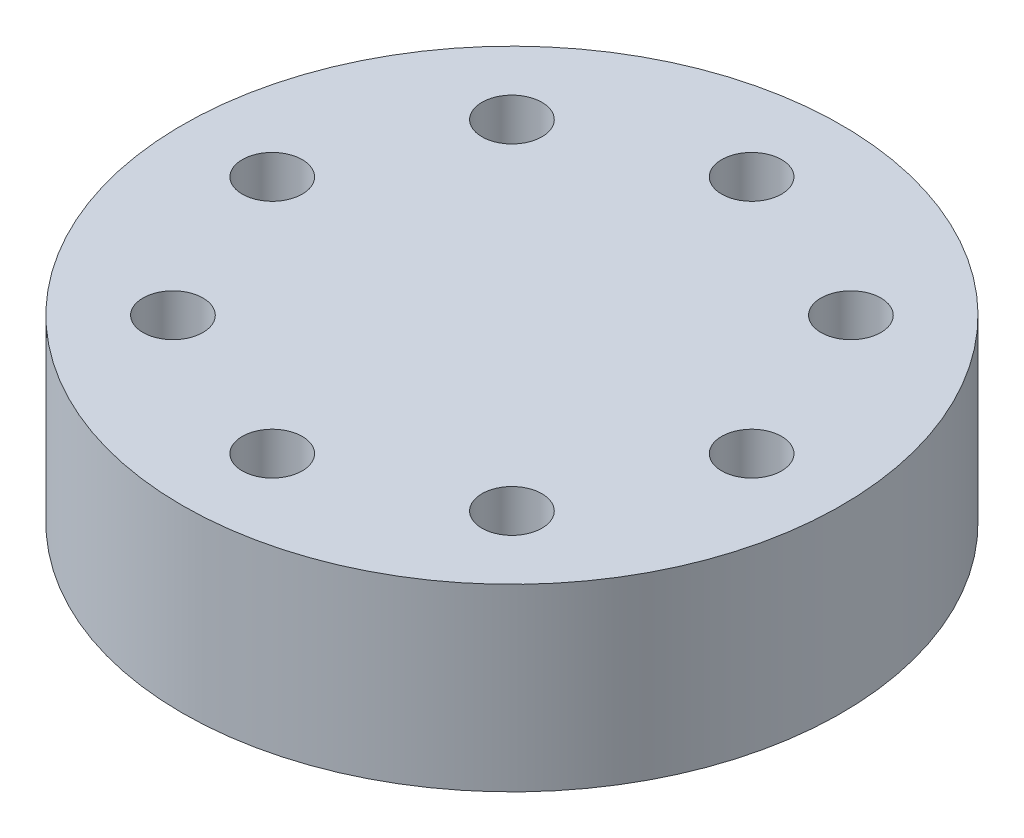
from build123d import *

# Parameters (mm, degrees)
SKETCH1_R           = 11
SKETCH1_R_2         = 1
BOSS_EXTRUDE1_DEPTH = 6
SKETCH2_R           = 4
CUT_EXTRUDE1_DEPTH  = 5.5


with BuildPart() as part:
    # Sketch1 → Boss-Extrude1 (new body)
    with BuildSketch(Plane(origin=(0, 0, 0), x_dir=(1, 0, 0), z_dir=(0, 1, 0))):
        with Locations(Location((0, 0, 0), (0, 0, 270))):
            Circle(SKETCH1_R)
        with Locations(Location((0, 8, 0), (0, 0, 270))):
            Circle(SKETCH1_R_2, mode=Mode.SUBTRACT)
        with Locations(Location((5.656854249, 5.656854249, 0), (0, 0, 270))):
            Circle(SKETCH1_R_2, mode=Mode.SUBTRACT)
        with Locations(Location((8, 0, 0), (0, 0, 270))):
            Circle(SKETCH1_R_2, mode=Mode.SUBTRACT)
        with Locations(Location((5.656854249, -5.656854249, 0), (0, 0, 270))):
            Circle(SKETCH1_R_2, mode=Mode.SUBTRACT)
        with Locations(Location((0, -8, 0), (0, 0, 270))):
            Circle(SKETCH1_R_2, mode=Mode.SUBTRACT)
        with Locations(Location((-5.656854249, -5.656854249, 0), (0, 0, 270))):
            Circle(SKETCH1_R_2, mode=Mode.SUBTRACT)
        with Locations(Location((-8, 0, 0), (0, 0, 270))):
            Circle(SKETCH1_R_2, mode=Mode.SUBTRACT)
        with Locations(Location((-5.656854249, 5.656854249, 0), (0, 0, 270))):
            Circle(SKETCH1_R_2, mode=Mode.SUBTRACT)
    extrude(amount=BOSS_EXTRUDE1_DEPTH)

    # Sketch2 → Cut-Extrude1 (cut)
    with BuildSketch(Plane.XZ):
        with Locations(Location((0, 0, 0), (0, 0, 270))):
            Circle(SKETCH2_R)
    extrude(amount=-CUT_EXTRUDE1_DEPTH, mode=Mode.SUBTRACT)


solid = part.part
